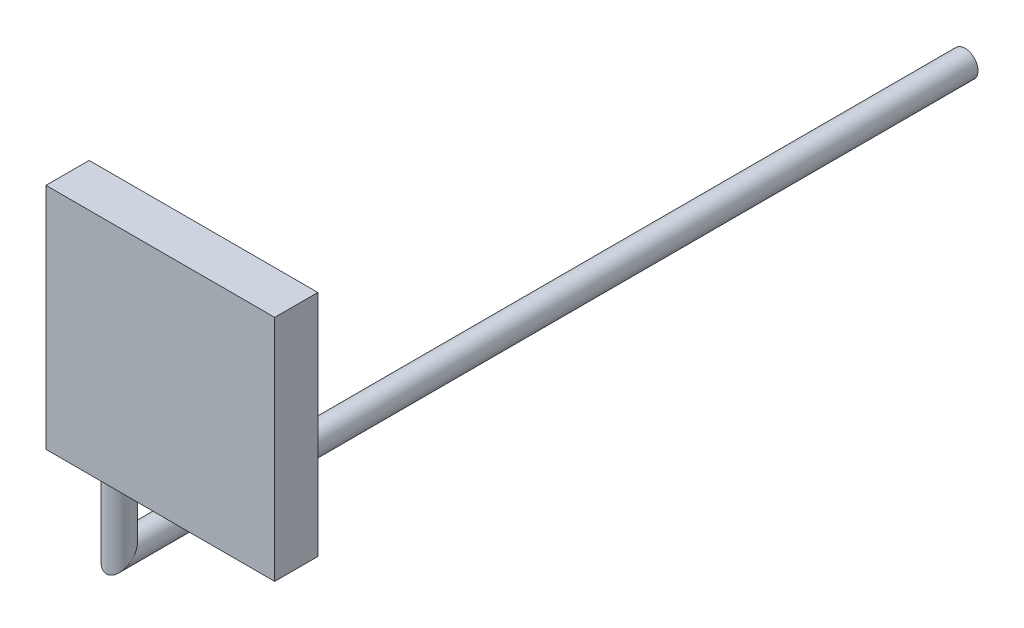
from build123d import *

# Parameters (mm, degrees)
SKETCH_1_W      = 53
SKETCH_1_H      = 53
EXTRUDE_1_DEPTH = 10
SKETCH_2_R      = 3


with BuildPart() as part:
    # 草图1 → 凸台-拉伸1 (new body)
    with BuildSketch(Plane.XY):
        with Locations((26.5, 26.5)):
            Rectangle(SKETCH_1_W, SKETCH_1_H)
    extrude(amount=EXTRUDE_1_DEPTH)

    # 扫描1: sweep along a path in 草图4
    with BuildLine(Plane(origin=(0, 0, 0), x_dir=(0, 0, -1), z_dir=(1, 0, 0))) as sweep_1_path:
        Line((-5, 0), (-5, -17))
        Line((-5, -17), (191, -17))
    # 草图2 → 扫描1 (sweep)
    with BuildSketch(Plane(origin=(0, 0, 0), x_dir=(1, 0, 0), z_dir=(0, 1, 0))):
        with Locations((12, -5)):
            Circle(SKETCH_2_R)
    sweep(path=sweep_1_path.line, transition=Transition.RIGHT)


solid = part.part
